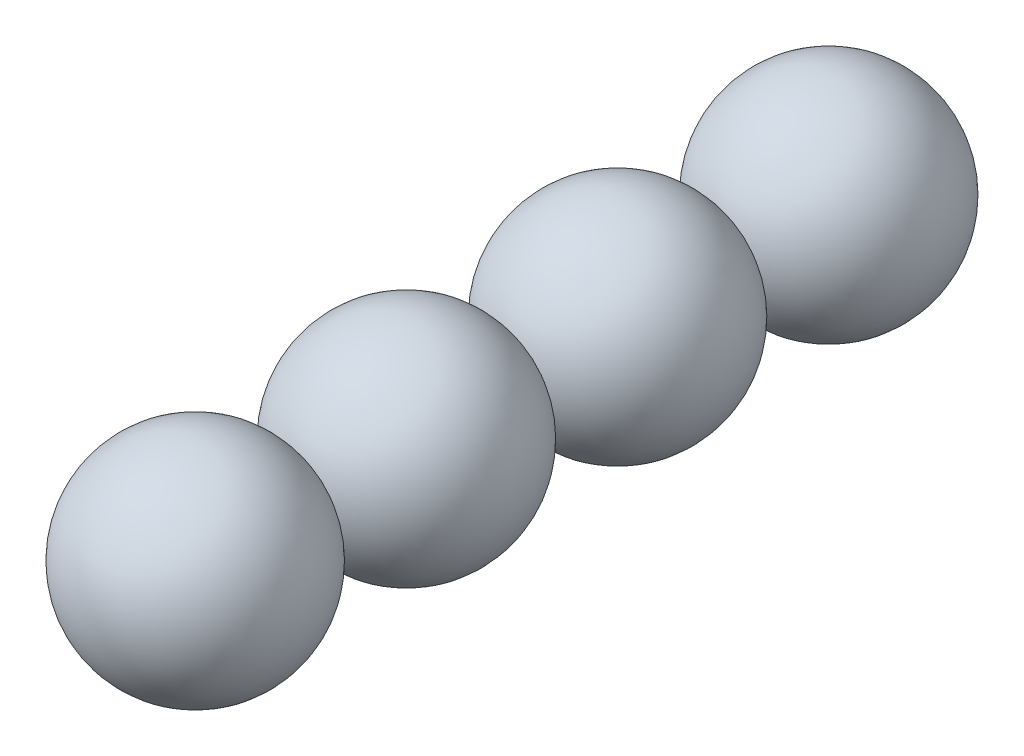
from build123d import *

# Parameters (mm, degrees)
PATTERN_LINEAR_1_COUNT = 4
PATTERN_LINEAR_1_PITCH = 60


with BuildPart() as part:
    # 草圖1 → 旋轉1 (revolve)
    with BuildSketch(Plane.XY):
        with BuildLine():
            Line((0, 30), (0, -30))
            ThreePointArc((0, -30), (30, 0), (0, 30))
        make_face()
    revolve(axis=Axis((0, 30, 0), (0, -1, 0)))


with BuildPart() as pattern_linear_1_1:
    # 直線複製排列1: pattern copy
    add(part.part.moved(Location(Vector(0, 0, 1) * (1 * PATTERN_LINEAR_1_PITCH))))


with BuildPart() as pattern_linear_1_2:
    # 直線複製排列1: pattern copy
    add(part.part.moved(Location(Vector(0, 0, 1) * (2 * PATTERN_LINEAR_1_PITCH))))


with BuildPart() as pattern_linear_1_3:
    # 直線複製排列1: pattern copy
    add(part.part.moved(Location(Vector(0, 0, 1) * (3 * PATTERN_LINEAR_1_PITCH))))


solid = Compound([part.part, pattern_linear_1_1.part, pattern_linear_1_2.part, pattern_linear_1_3.part])
